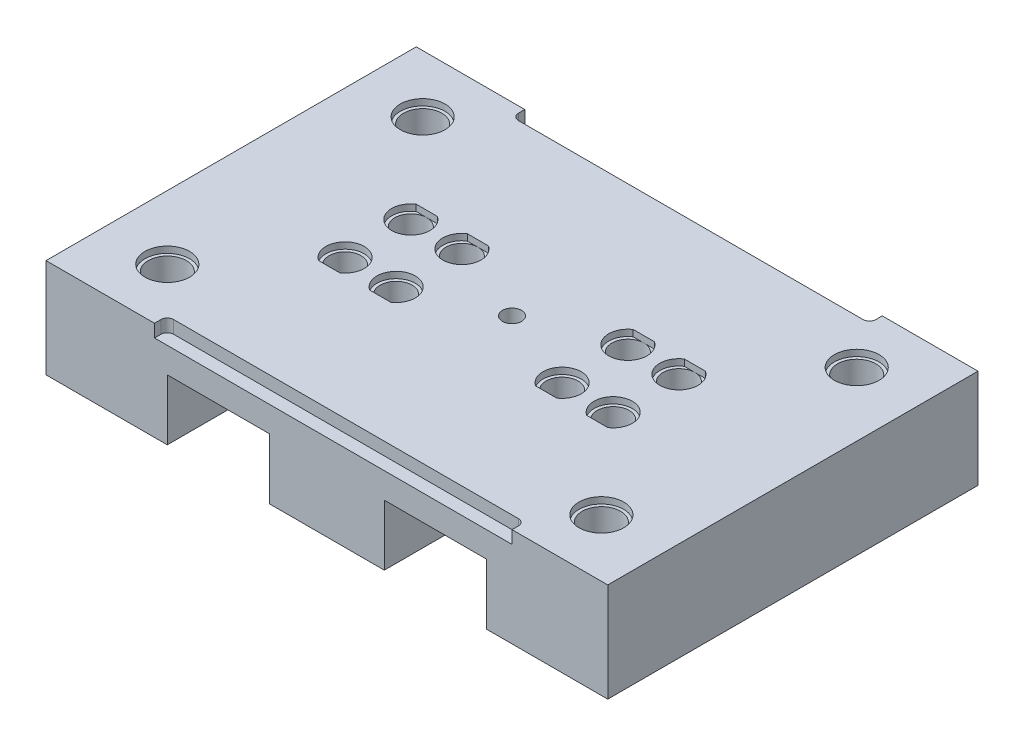
from build123d import *

# Parameters (mm, degrees)
SKETCH1_W               = 880
SKETCH1_H               = 580
BOSS_EXTRUDE1_DEPTH     = 155
SKETCH2_W               = 160
SKETCH2_H               = 95
CUT_EXTRUDE1_DEPTH      = 705
SKETCH3_R               = 30
CUT_EXTRUDE2_DEPTH      = 10
SKETCH4_R               = 25
CUT_EXTRUDE3_DEPTH      = 60
MIRROR3_COPY_1_SKETCH_R = 30
MIRROR3_COPY_1_DEPTH    = 10
MIRROR3_COPY_2_SKETCH_R = 25
MIRROR3_COPY_2_DEPTH    = 60
SKETCH5_W               = 578.085734934
SKETCH5_H               = 25.310233579
BOSS_EXTRUDE2_DEPTH     = 18
CUT_EXTRUDE5_DEPTH      = 10
SKETCH7_R               = 15
CUT_EXTRUDE6_DEPTH      = 440
SKETCH8_R               = 35
CUT_EXTRUDE7_DEPTH      = 10
SKETCH9_R               = 30
CUT_EXTRUDE8_DEPTH      = 413
SKETCH10_W              = 560
SKETCH10_H              = 20
CUT_EXTRUDE9_DEPTH      = 20
FILLET1_R               = 10
FILLET1_OF_MIRROR5_R    = 10


with BuildPart() as part:
    # Sketch1 → Boss-Extrude1 (new body)
    with BuildSketch(Plane(origin=(0, 0, 0), x_dir=(1, 0, 0), z_dir=(0, 1, 0))):
        Rectangle(SKETCH1_W, SKETCH1_H)
    extrude(amount=BOSS_EXTRUDE1_DEPTH)

    # Sketch2 → Cut-Extrude1 (cut)
    with BuildSketch(Plane.XY.offset(290)):
        with Locations((-170, 47.5)):
            Rectangle(SKETCH2_W, SKETCH2_H)
    cut_extrude1 = extrude(amount=-CUT_EXTRUDE1_DEPTH, mode=Mode.SUBTRACT)

    # Mirror1: Cut-Extrude1 across plane
    add(cut_extrude1.mirror(Plane(origin=(0, 0, 0), x_dir=(0, 0, 1), z_dir=(1, 0, 0))), mode=Mode.SUBTRACT)

    # Sketch3 → Cut-Extrude2 (cut)
    with BuildSketch(Plane(origin=(0, 155, 0), x_dir=(1, 0, 0), z_dir=(0, 1, 0))):
        with Locations(Location((-210, -51.5, 0), (0, 0, 270))):
            Circle(SKETCH3_R)
        with Locations(Location((-130, -51.5, 0), (0, 0, 270))):
            Circle(SKETCH3_R)
    cut_extrude2 = extrude(amount=-CUT_EXTRUDE2_DEPTH, mode=Mode.SUBTRACT)

    # Sketch4 → Cut-Extrude3 (cut)
    with BuildSketch(Plane(origin=(0, 145, 0), x_dir=(1, 0, 0), z_dir=(0, 1, 0))):
        with Locations(Location((-210, -51.5, 0), (0, 0, 270))):
            Circle(SKETCH4_R)
        with Locations(Location((-130, -51.5, 0), (0, 0, 270))):
            Circle(SKETCH4_R)
    cut_extrude3 = extrude(amount=-CUT_EXTRUDE3_DEPTH, mode=Mode.SUBTRACT)

    # Mirror2: Cut-Extrude2, Cut-Extrude3 across plane
    add(cut_extrude2.mirror(Plane(origin=(0, 0, 0), x_dir=(0, 0, 1), z_dir=(1, 0, 0))), mode=Mode.SUBTRACT)
    add(cut_extrude3.mirror(Plane(origin=(0, 0, 0), x_dir=(0, 0, 1), z_dir=(1, 0, 0))), mode=Mode.SUBTRACT)

    # Mirror3: Cut-Extrude2, Cut-Extrude3 across plane
    add(cut_extrude2.mirror(Plane.XY), mode=Mode.SUBTRACT)
    add(cut_extrude3.mirror(Plane.XY), mode=Mode.SUBTRACT)

    # Mirror3 copy 1 sketch → Mirror3 copy 1 (cut)
    with BuildSketch(Plane(origin=(0, 155, 0), x_dir=(-1, 0, 0), z_dir=(0, 1, 0))):
        with Locations(Location((-210, -51.5, 0), (0, 0, 270))):
            Circle(MIRROR3_COPY_1_SKETCH_R)
        with Locations(Location((-130, -51.5, 0), (0, 0, 270))):
            Circle(MIRROR3_COPY_1_SKETCH_R)
    extrude(amount=-MIRROR3_COPY_1_DEPTH, mode=Mode.SUBTRACT)

    # Mirror3 copy 2 sketch → Mirror3 copy 2 (cut)
    with BuildSketch(Plane(origin=(0, 145, 0), x_dir=(-1, 0, 0), z_dir=(0, 1, 0))):
        with Locations(Location((-210, -51.5, 0), (0, 0, 270))):
            Circle(MIRROR3_COPY_2_SKETCH_R)
        with Locations(Location((-130, -51.5, 0), (0, 0, 270))):
            Circle(MIRROR3_COPY_2_SKETCH_R)
    extrude(amount=-MIRROR3_COPY_2_DEPTH, mode=Mode.SUBTRACT)

    # Sketch5 → Boss-Extrude2 (add)
    with BuildSketch(Plane(origin=(0, 155, 0), x_dir=(1, 0, 0), z_dir=(0, 1, 0))):
        with Locations((-4.358544199, 89.155116789)):
            Rectangle(SKETCH5_W, SKETCH5_H)
    boss_extrude2 = extrude(amount=-BOSS_EXTRUDE2_DEPTH)

    # Mirror4: Boss-Extrude2 across plane
    add(boss_extrude2.mirror(Plane.XY))

    # Sketch6 → Cut-Extrude5 (cut)
    with BuildSketch(Plane.XZ.offset(-95)):
        with BuildLine():
            Line((-200, 165), (-140, 165))
            ThreePointArc((-140, 165), (-125, 150), (-140, 135))
            Line((-140, 135), (-200, 135))
            ThreePointArc((-200, 135), (-215, 150), (-200, 165))
        make_face()
        with BuildLine():
            Line((200, 165), (140, 165))
            ThreePointArc((140, 165), (125, 150), (140, 135))
            Line((140, 135), (200, 135))
            ThreePointArc((200, 135), (215, 150), (200, 165))
        make_face()
        with BuildLine():
            Line((200, -165), (140, -165))
            ThreePointArc((140, -165), (125, -150), (140, -135))
            Line((140, -135), (200, -135))
            ThreePointArc((200, -135), (215, -150), (200, -165))
        make_face()
        with BuildLine():
            Line((-200, -165), (-140, -165))
            ThreePointArc((-140, -165), (-125, -150), (-140, -135))
            Line((-140, -135), (-200, -135))
            ThreePointArc((-200, -135), (-215, -150), (-200, -165))
        make_face()
    extrude(amount=-CUT_EXTRUDE5_DEPTH, mode=Mode.SUBTRACT)

    # Sketch7 → Cut-Extrude6 (cut)
    with BuildSketch(Plane.XZ):
        with Locations(Location((0, 0, 0), (0, 0, 270))):
            Circle(SKETCH7_R)
    extrude(amount=-CUT_EXTRUDE6_DEPTH, mode=Mode.SUBTRACT)

    # Sketch8 → Cut-Extrude7 (cut)
    with BuildSketch(Plane(origin=(0, 155, 0), x_dir=(1, 0, 0), z_dir=(0, 1, 0))):
        with Locations(Location((-340, 200, 0), (0, 0, 270))):
            Circle(SKETCH8_R)
        with Locations(Location((340, 200, 0), (0, 0, 270))):
            Circle(SKETCH8_R)
        with Locations(Location((340, -200, 0), (0, 0, 90))):
            Circle(SKETCH8_R)
        with Locations(Location((-340, -200, 0), (0, 0, 90))):
            Circle(SKETCH8_R)
    extrude(amount=-CUT_EXTRUDE7_DEPTH, mode=Mode.SUBTRACT)

    # Sketch9 → Cut-Extrude8 (cut)
    with BuildSketch(Plane(origin=(0, 155, 0), x_dir=(1, 0, 0), z_dir=(0, 1, 0))):
        with Locations(Location((-340, 200, 0), (0, 0, 270))):
            Circle(SKETCH9_R)
        with Locations(Location((340, 200, 0), (0, 0, 270))):
            Circle(SKETCH9_R)
        with Locations(Location((340, -200, 0), (0, 0, 270))):
            Circle(SKETCH9_R)
        with Locations(Location((-340, -200, 0), (0, 0, 270))):
            Circle(SKETCH9_R)
    extrude(amount=-CUT_EXTRUDE8_DEPTH, mode=Mode.SUBTRACT)

    # Sketch10 → Cut-Extrude9 (cut)
    with BuildSketch(Plane(origin=(0, 155, 0), x_dir=(1, 0, 0), z_dir=(0, 1, 0))):
        with Locations((10, 280)):
            Rectangle(SKETCH10_W, SKETCH10_H)
    cut_extrude9 = extrude(amount=-CUT_EXTRUDE9_DEPTH, mode=Mode.SUBTRACT)

    # Fillet1
    fillet1_edges = [part.edges().sort_by_distance(p)[0] for p in [
        (-270, 145, -270),
        (290, 145, -270),
    ]]
    fillet(fillet1_edges, radius=FILLET1_R)

    # Mirror5: Cut-Extrude9 across plane
    add(cut_extrude9.mirror(Plane.XY), mode=Mode.SUBTRACT)

    # Fillet1 of Mirror5
    fillet1_of_mirror5_edges = [part.edges().sort_by_distance(p)[0] for p in [
        (-270, 145, 270),
        (290, 145, 270),
    ]]
    fillet(fillet1_of_mirror5_edges, radius=FILLET1_OF_MIRROR5_R)


solid = part.part
